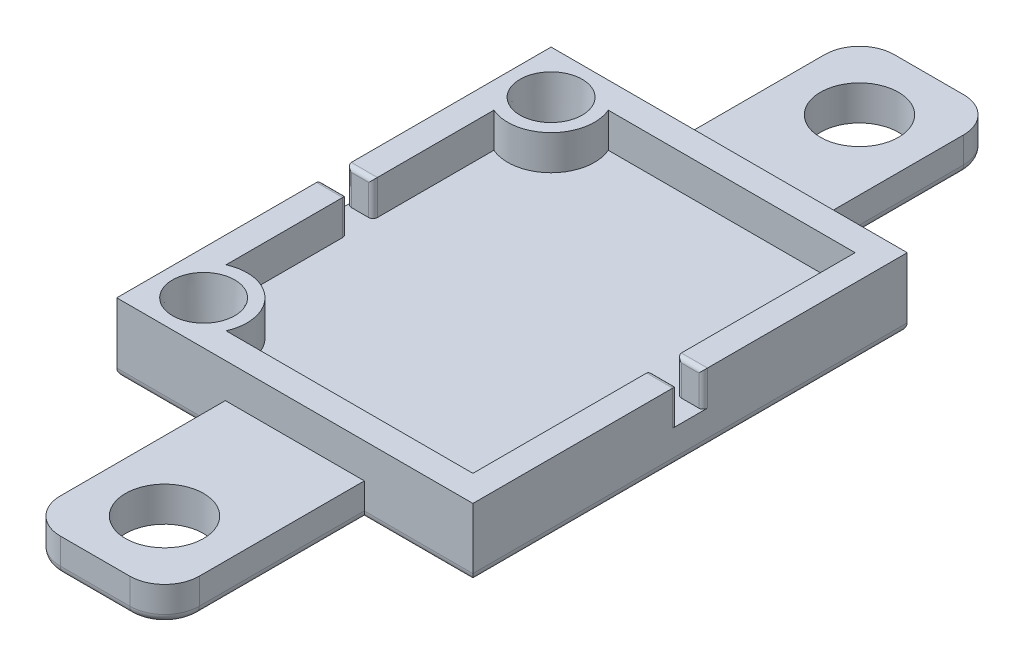
from build123d import *

# Parameters (mm, degrees)
SKETCH2_W           = 20.5
SKETCH2_H           = 25
SKETCH2_R           = 1.15
BOSS_EXTRUDE1_DEPTH = 4
SKETCH3_OUTSIDE_W   = 29.016
SKETCH3_OUTSIDE_H   = 33.516
SKETCH3_OUTSIDE_W_2 = 20.5
SKETCH3_OUTSIDE_H_2 = 25
CUT_EXTRUDE1_DEPTH  = 2
SKETCH4_R           = 1.79
CUT_EXTRUDE2_DEPTH  = 2.92
DRAFT1_ANGLE        = 4
SKETCH5_W           = 8
SKETCH5_H           = 11.5
SKETCH5_R           = 2.2479
BOSS_EXTRUDE2_DEPTH = 2
FILLET1_R           = 2
FILLET2_R           = 0.5
SKETCH7_W           = 1.5
SKETCH7_H           = 2
CUT_EXTRUDE4_DEPTH  = 32.81587654
FILLET3_R           = 0.25


with BuildPart() as part:
    # Sketch2 → Boss-Extrude1 (new body)
    with BuildSketch(Plane(origin=(0, 0, 0), x_dir=(1, 0, 0), z_dir=(0, 1, 0))):
        Rectangle(SKETCH2_W, SKETCH2_H)
        with Locations(Location((-7.75, 10, 0), (0, 0, 270))):
            Circle(SKETCH2_R, mode=Mode.SUBTRACT)
        with Locations(Location((-7.75, -10, 0), (0, 0, 90))):
            Circle(SKETCH2_R, mode=Mode.SUBTRACT)
    extrude(amount=BOSS_EXTRUDE1_DEPTH)

    # Sketch3 outside → Cut-Extrude1 (cut)
    # profile 1 of 2: a face of its own
    with BuildSketch(Plane(origin=(0, 4, 0), x_dir=(1, 0, 0), z_dir=(0, 1, 0))):
        Rectangle(SKETCH3_OUTSIDE_W, SKETCH3_OUTSIDE_H)
        Rectangle(SKETCH3_OUTSIDE_W_2, SKETCH3_OUTSIDE_H_2, mode=Mode.SUBTRACT)
    # profile 2 of 2: a face of its own
    with BuildSketch(Plane(origin=(0, 4, 0), x_dir=(1, 0, 0), z_dir=(0, 1, 0))):
        with BuildLine():
            Line((-5.458712153, 11), (8.75, 11))
            Line((8.75, 11), (8.75, -11))
            Line((8.75, -11), (-5.458712153, -11))
            ThreePointArc((-5.458712153, -11), (-5.982233047, -8.232233047), (-8.75, -7.708712153))
            Line((-8.75, -7.708712153), (-8.75, 7.708712153))
            ThreePointArc((-8.75, 7.708712153), (-5.982233047, 8.232233047), (-5.458712153, 11))
        make_face()
    extrude(amount=-CUT_EXTRUDE1_DEPTH, mode=Mode.SUBTRACT)

    # Sketch4 → Cut-Extrude2 (cut)
    with BuildSketch(Plane(origin=(0, 4, 0), x_dir=(1, 0, 0), z_dir=(0, 1, 0))):
        with Locations(Location((-7.75, 10, 0), (0, 0, 270))):
            Circle(SKETCH4_R)
        with Locations(Location((-7.75, -10, 0), (0, 0, 90))):
            Circle(SKETCH4_R)
    extrude(amount=-CUT_EXTRUDE2_DEPTH, mode=Mode.SUBTRACT)

    # Draft1
    draft1_faces = [part.faces().sort_by_distance(p)[0] for p in [
        (-7.75, 2.54, 11.79),
        (-7.75, 2.54, -11.79),
    ]]
    draft(draft1_faces, Plane.ZX.offset(4), DRAFT1_ANGLE)

    # Sketch5 → Boss-Extrude2 (add)
    # profile 1 of 2: a face of its own
    with BuildSketch(Plane.XZ):
        with Locations((0, 18.25)):
            Rectangle(SKETCH5_W, SKETCH5_H)
        with Locations(Location((0, 20, 0), (0, 0, 270))):
            Circle(SKETCH5_R, mode=Mode.SUBTRACT)
    # profile 2 of 2: a face of its own
    with BuildSketch(Plane.XZ):
        with Locations((0, -18.25)):
            Rectangle(SKETCH5_W, SKETCH5_H)
        with Locations(Location((0, -20, 0), (0, 0, 90))):
            Circle(SKETCH5_R, mode=Mode.SUBTRACT)
    extrude(amount=-BOSS_EXTRUDE2_DEPTH)

    # Fillet1
    fillet1_edges = [part.edges().sort_by_distance(p)[0] for p in [
        (4, 1, 24),
        (-4, 1, 24),
        (4, 1, -24),
        (-4, 1, -24),
    ]]
    fillet(fillet1_edges, radius=FILLET1_R)

    # Fillet2
    fillet2_edges = [part.edges().sort_by_distance(p)[0] for p in [
        (7.125, 0, 12.5),
        (4, 0, 17.25),
        (-7.125, 0, -12.5),
        (-4, 0, -17.25),
        (0, 0, 24),
        (-4, 0, 17.25),
        (0, 0, -24),
        (4, 0, -17.25),
        (-3.414213562, 0, 23.414213562),
        (3.414213562, 0, 23.414213562),
        (3.414213562, 0, -23.414213562),
        (-3.414213562, 0, -23.414213562),
        (-7.125, 0, 12.5),
        (-10.25, 0, 0),
        (7.125, 0, -12.5),
        (10.25, 0, 0),
    ]]
    fillet(fillet2_edges, radius=FILLET2_R)

    # Sketch7 → Cut-Extrude4 (cut, through all)
    with BuildSketch(Plane.ZY.offset(10.25)):
        with Locations((0, 3)):
            Rectangle(SKETCH7_W, SKETCH7_H)
    extrude(amount=-CUT_EXTRUDE4_DEPTH, mode=Mode.SUBTRACT)

    # Fillet3
    fillet3_edges = [part.edges().sort_by_distance(p)[0] for p in [
        (9.5, 4, -0.75),
        (-9.5, 4, -0.75),
        (9.5, 4, 0.75),
        (8.75, 3, 0.75),
        (10.25, 3, 0.75),
        (-8.75, 3, 0.75),
        (-9.5, 4, 0.75),
        (8.75, 3, -0.75),
        (10.25, 3, -0.75),
        (-8.75, 3, -0.75),
        (-10.25, 3, 0.75),
        (-10.25, 3, -0.75),
    ]]
    fillet(fillet3_edges, radius=FILLET3_R)


solid = part.part
